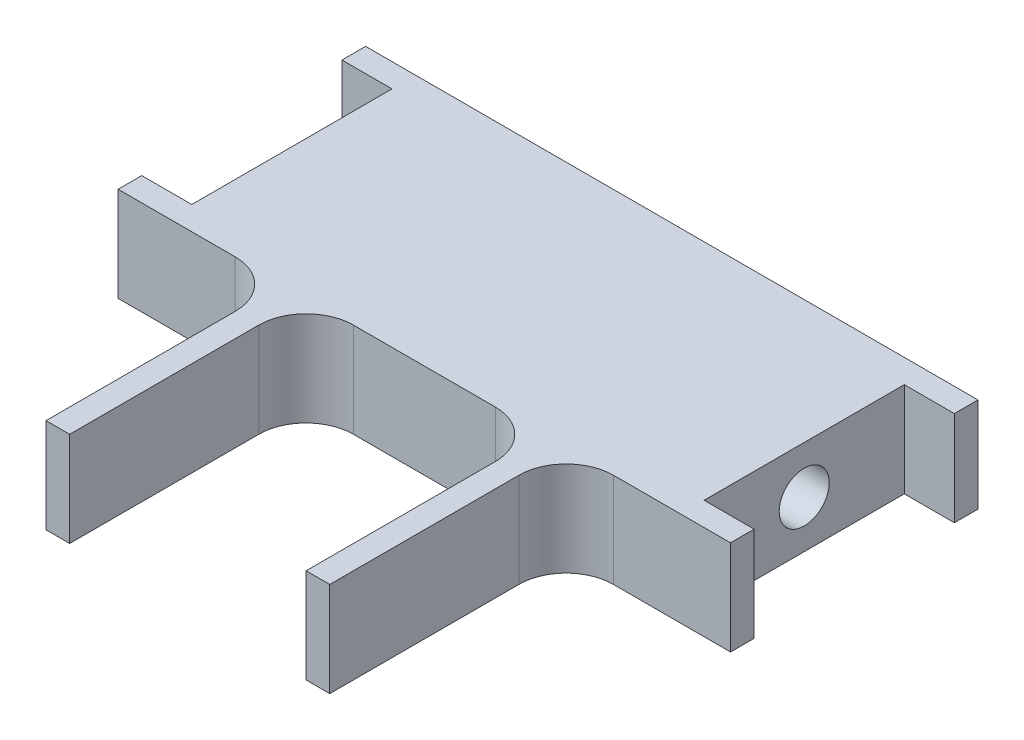
from build123d import *

# Parameters (mm, degrees)
BOSS_EXTRUDE1_DEPTH = 12
SKETCH2_R           = 3.175
CUT_EXTRUDE1_DEPTH  = 79.871937341
SKETCH3_W           = 3
SKETCH3_H           = 12
BOSS_EXTRUDE2_DEPTH = 30
FILLET1_R           = 6


with BuildPart() as part:
    # Sketch1 → Boss-Extrude1 (new body)
    with BuildSketch(Plane(origin=(0, 0, 0), x_dir=(1, 0, 0), z_dir=(0, 1, 0))):
        Polygon((0, 0), (0, 3), (6.35, 3), (6.35, 28.4), (0, 28.4), (0, 31.4), (77.7, 31.4), (77.7, 28.4), (71.35, 28.4), (71.35, 3), (77.7, 3), (77.7, 0), align=None)
    extrude(amount=BOSS_EXTRUDE1_DEPTH)

    # Sketch2 → Cut-Extrude1 (cut, through all)
    with BuildSketch(Plane.ZY.offset(-6.35)):
        with Locations((-15.7, 6)):
            Circle(SKETCH2_R)
    extrude(amount=-CUT_EXTRUDE1_DEPTH, mode=Mode.SUBTRACT)

    # Sketch3 → Boss-Extrude2 (add)
    with BuildSketch(Plane.XY):
        with Locations((22.35, 6)):
            Rectangle(SKETCH3_W, SKETCH3_H)
        with Locations((55.35, 6)):
            Rectangle(SKETCH3_W, SKETCH3_H)
    extrude(amount=BOSS_EXTRUDE2_DEPTH)

    # Fillet1
    fillet1_edges = [part.edges().sort_by_distance(p)[0] for p in [
        (20.85, 6, 0),
        (53.85, 6, 0),
        (23.85, 6, 0),
        (56.85, 6, 0),
    ]]
    fillet(fillet1_edges, radius=FILLET1_R)


solid = part.part
